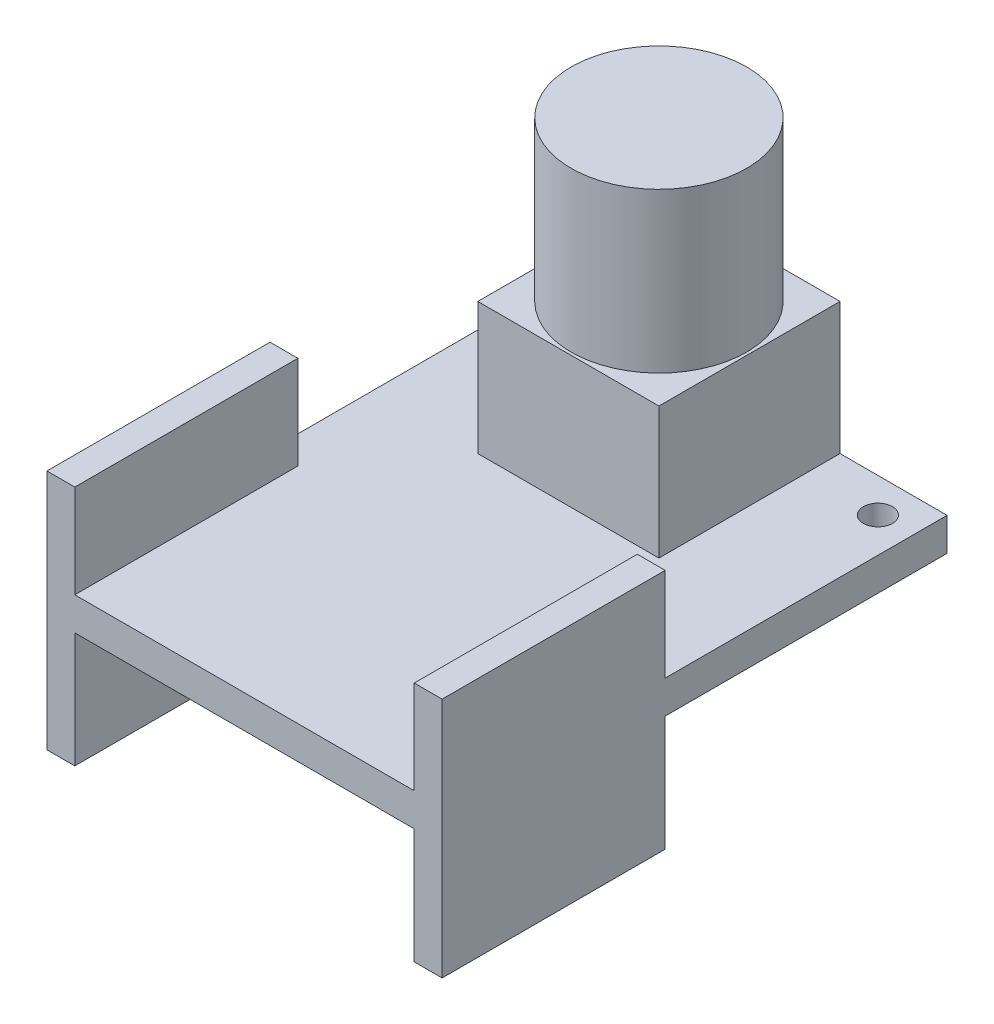
from build123d import *

# Parameters (mm, degrees)
SKETCH_1_W           = 36
SKETCH_1_H           = 46
EXTRUDE_1_DEPTH      = 3
EXTRUDE_2_DEPTH      = 8.5
EXTRUDE_2_DEPTH_BACK = 13.5
SKETCH_2_W           = 2.54
SKETCH_2_H           = 20.32
SKETCH_2_W_2         = 16.5
SKETCH_2_H_2         = 16.5
SKETCH_3_W           = 16.5
SKETCH_3_H           = 16.5
EXTRUDE_3_DEPTH      = 3.5
SKETCH_4_R           = 8
EXTRUDE_4_DEPTH      = 14.5
SKETCH_5_R           = 1.325
CUT_EXTRUDE_1_DEPTH  = 14.5
SKETCH_7_W           = 16.5
SKETCH_7_H           = 10.5
CUT_EXTRUDE_2_DEPTH  = 31.5


with BuildPart() as part:
    # 草图1 → 凸台-拉伸1 (new body)
    with BuildSketch(Plane(origin=(0, 0, 0), x_dir=(1, 0, 0), z_dir=(0, 1, 0))):
        Rectangle(SKETCH_1_W, SKETCH_1_H)
    extrude(amount=EXTRUDE_1_DEPTH)

    # 草图2 → 凸台-拉伸2 (add, two sides: drawn at the far end of the back side and taken through both)
    with BuildSketch(Plane(origin=(0, 3, 0), x_dir=(1, 0, 0), z_dir=(0, 1, 0)).offset(-EXTRUDE_2_DEPTH_BACK)):
        with Locations((16.73, -12.84)):
            Rectangle(SKETCH_2_W, SKETCH_2_H)
        with Locations((-16.73, -12.84)):
            Rectangle(SKETCH_2_W, SKETCH_2_H)
        with Locations((0, 14.75)):
            Rectangle(SKETCH_2_W_2, SKETCH_2_H_2)
    extrude(amount=EXTRUDE_2_DEPTH + EXTRUDE_2_DEPTH_BACK)

    # 草图3 → 凸台-拉伸3 (add)
    with BuildSketch(Plane(origin=(0, 11.5, 0), x_dir=(1, 0, 0), z_dir=(0, 1, 0))):
        with Locations((0, 14.75)):
            Rectangle(SKETCH_3_W, SKETCH_3_H)
    extrude(amount=EXTRUDE_3_DEPTH)

    # 草图4 → 凸台-拉伸4 (add)
    with BuildSketch(Plane(origin=(0, 15, 0), x_dir=(1, 0, 0), z_dir=(0, 1, 0))):
        with Locations(Location((0, 14.75, 0), (0, 0, 90))):
            Circle(SKETCH_4_R)
    extrude(amount=EXTRUDE_4_DEPTH)

    # 草图5 → 切除-拉伸1 (cut)
    with BuildSketch(Plane(origin=(0, 3, 0), x_dir=(1, 0, 0), z_dir=(0, 1, 0))):
        with Locations(Location((-14.825, 19.875, 0), (0, 0, 270))):
            Circle(SKETCH_5_R)
        with Locations(Location((14.825, 19.875, 0), (0, 0, 270))):
            Circle(SKETCH_5_R)
    extrude(amount=-CUT_EXTRUDE_1_DEPTH, mode=Mode.SUBTRACT)

    # 草图7 → 切除-拉伸2 (cut)
    with BuildSketch(Plane.ZY.offset(8.25)):
        with Locations((-14.75, -5.25)):
            Rectangle(SKETCH_7_W, SKETCH_7_H)
    extrude(amount=-CUT_EXTRUDE_2_DEPTH, mode=Mode.SUBTRACT)


solid = part.part
